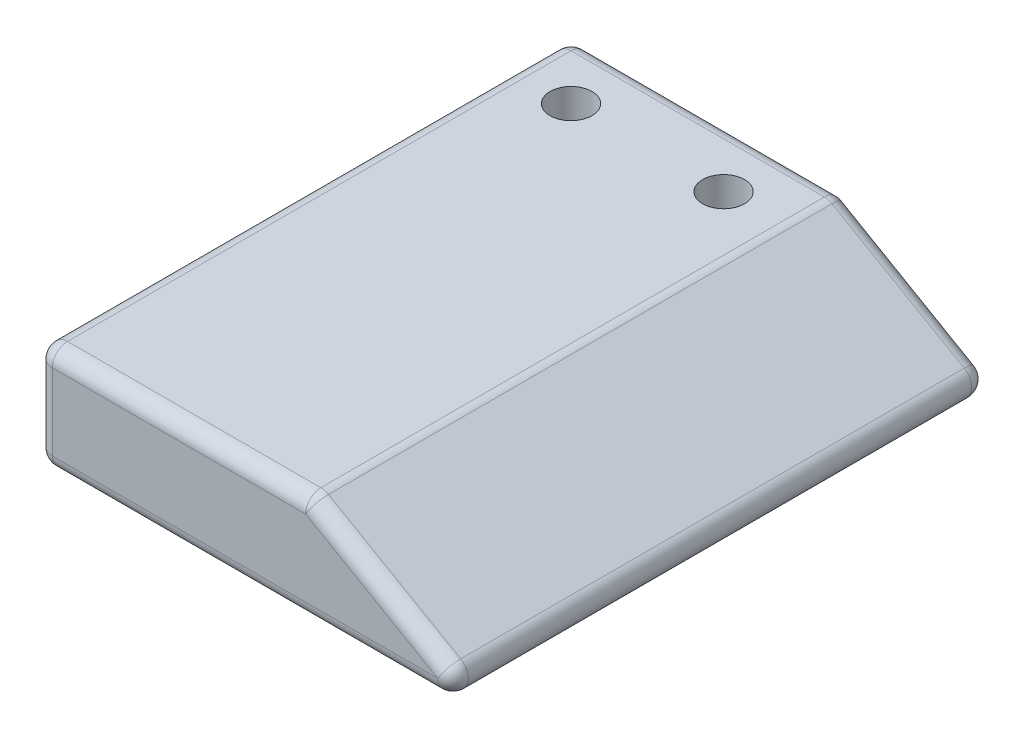
from build123d import *

# Parameters (mm, degrees)
BOSS_EXTRUDE1_DEPTH                                  = 70
CSK_FOR_M5_HEX_SOCKET_COUNTERSUNK_CAP_SC_D           = 5.5
CSK_FOR_M5_HEX_SOCKET_COUNTERSUNK_CAP_SC_CSINK_D     = 11.2
CSK_FOR_M5_HEX_SOCKET_COUNTERSUNK_CAP_SC_CSINK_ANGLE = 90
FILLET1_R                                            = 2


with BuildPart() as part:
    # Sketch1 → Boss-Extrude1 (new body)
    with BuildSketch(Plane.XY):
        Polygon((0, 0), (0, 14), (35.751288694, 14), (60, 0), align=None)
    extrude(amount=BOSS_EXTRUDE1_DEPTH)

    # CSK for M5 Hex Socket Countersunk Cap Screw1 (through all)
    with Locations(Plane(origin=(0, 0, 0), x_dir=(-1, 0, 0), z_dir=(0, -1, 0))):
        with Locations((-8, -8), (-28, -8)):
            CounterSinkHole(CSK_FOR_M5_HEX_SOCKET_COUNTERSUNK_CAP_SC_D / 2, CSK_FOR_M5_HEX_SOCKET_COUNTERSUNK_CAP_SC_CSINK_D / 2, counter_sink_angle=CSK_FOR_M5_HEX_SOCKET_COUNTERSUNK_CAP_SC_CSINK_ANGLE)

    # Fillet1
    fillet1_edges = [part.edges().sort_by_distance(p)[0] for p in [
        (17.875644347, 14, 70),
        (0, 7, 70),
        (30, 0, 70),
        (0, 7, 0),
        (17.875644347, 14, 0),
        (47.875644347, 7, 0),
        (30, 0, 0),
        (0, 0, 35),
        (0, 14, 35),
        (35.751288694, 14, 35),
        (60, 0, 35),
        (47.875644347, 7, 70),
    ]]
    fillet(fillet1_edges, radius=FILLET1_R)


solid = part.part
